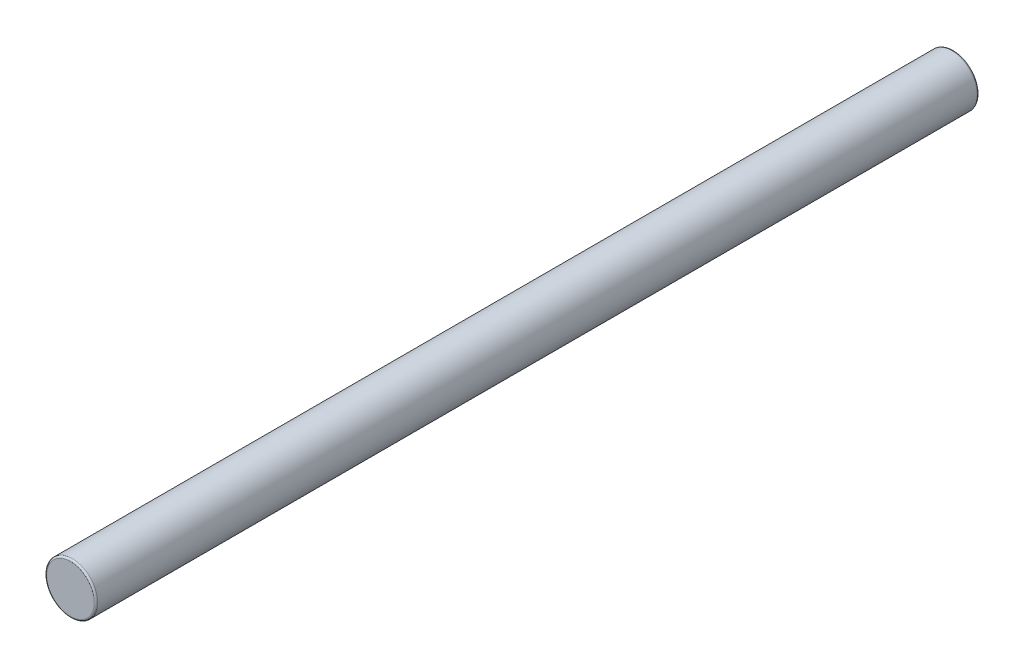
from build123d import *

# Parameters (mm, degrees)
ESQUISSE1_R      = 1.5
EXTRUSION1_DEPTH = 52
CONG_1_R         = 0.1


with BuildPart() as part:
    # Esquisse1 → Extrusion1 (new body)
    with BuildSketch(Plane.XY):
        with Locations(Location((0, 0, 0), (0, 0, 180))):
            Circle(ESQUISSE1_R)
    extrude(amount=EXTRUSION1_DEPTH)

    # Congé1
    cong_1_edges = [part.edges().sort_by_distance(p)[0] for p in [
        (1.5, 0, 0),
        (1.5, 0, 52),
    ]]
    fillet(cong_1_edges, radius=CONG_1_R)


solid = part.part
